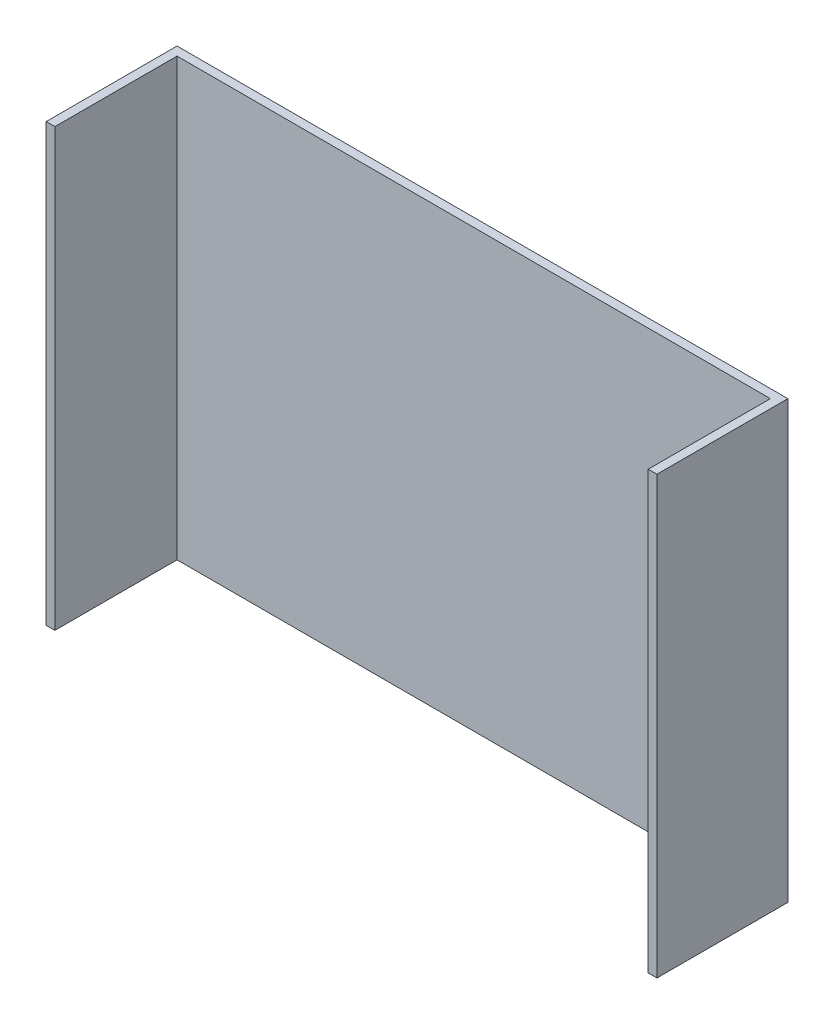
from build123d import *

# Parameters (mm, degrees)
SKETCH_1_W          = 140
SKETCH_1_H          = 100
EXTRUDE_1_DEPTH     = 30
SKETCH_2_W          = 136
SKETCH_2_H          = 100
CUT_EXTRUDE_1_DEPTH = 28


with BuildPart() as part:
    # 草圖1 → 填料-伸長1 (new body)
    with BuildSketch(Plane.XY):
        with Locations((-70, 50)):
            Rectangle(SKETCH_1_W, SKETCH_1_H)
    extrude(amount=EXTRUDE_1_DEPTH)

    # 草圖2 → 除料-伸長1 (cut)
    with BuildSketch(Plane.XY.offset(30)):
        with Locations((-70, 50)):
            Rectangle(SKETCH_2_W, SKETCH_2_H)
    extrude(amount=-CUT_EXTRUDE_1_DEPTH, mode=Mode.SUBTRACT)


solid = part.part
